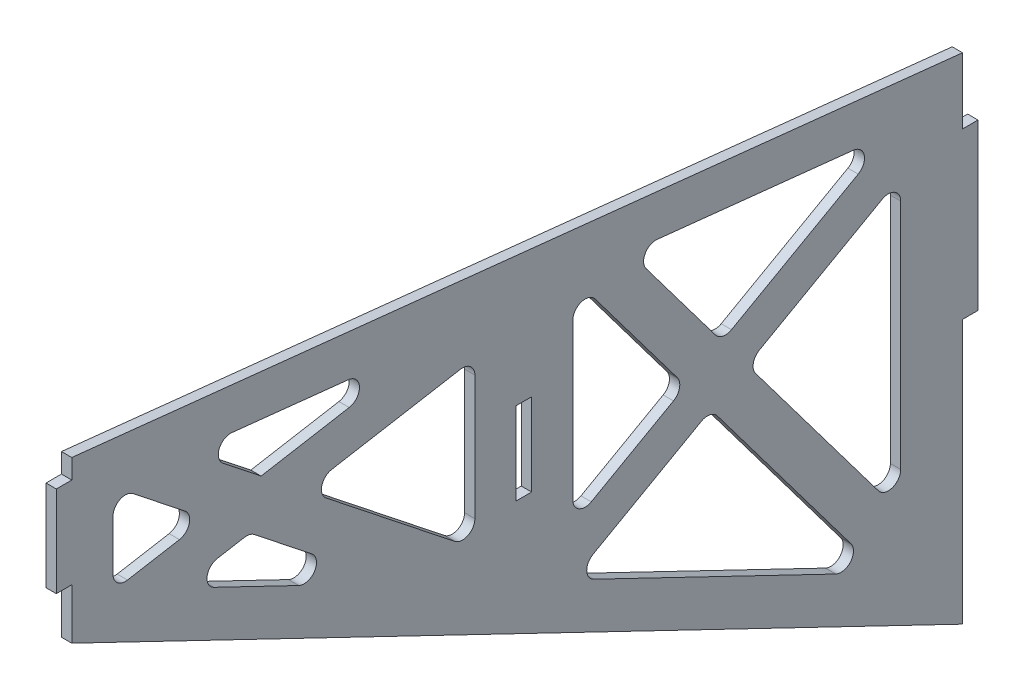
from build123d import *

# Parameters (mm, degrees)
BOSS_EXTRUDE1_DEPTH = 3.175
SKETCH4_W           = 4.7625
SKETCH4_H           = 25.4
CUT_EXTRUDE1_DEPTH  = 318.998242812
BOSS_EXTRUDE2_DEPTH = 3.175
SKETCH8_W           = 4.7625
SKETCH8_H           = 25.4
BOSS_EXTRUDE3_DEPTH = 3.175
CUT_EXTRUDE2_DEPTH  = 3.175
FILLET1_R           = 3.81


with BuildPart() as part:
    # Sketch3 → Boss-Extrude1 (new body)
    with BuildSketch(Plane(origin=(0, 0, 0), x_dir=(0, 0, -1), z_dir=(1, 0, 0))):
        Polygon((0, 0), (274.32, 0), (274.32, -20.32), (279.0825, -20.32), (279.0825, -71.12), (274.32, -71.12), (274.32, -152.4), (0, -20.32), (0, -4.736956919), (-4.7625, -4.736956919), (-4.7625, -2.196956919), (0, -2.196956919), align=None)
    extrude(amount=BOSS_EXTRUDE1_DEPTH)

    # Sketch4 → Cut-Extrude1 (cut, through all)
    with BuildSketch(Plane(origin=(3.175, 0, 0), x_dir=(0, 0, -1), z_dir=(1, 0, 0))):
        with Locations((139.22375, -38.1)):
            Rectangle(SKETCH4_W, SKETCH4_H)
    extrude(amount=-CUT_EXTRUDE1_DEPTH, mode=Mode.SUBTRACT)

    # Sketch7 → Boss-Extrude2 (add)
    with BuildSketch(Plane(origin=(3.175, 0, 0), x_dir=(0, 0, -1), z_dir=(1, 0, 0))):
        Polygon((0, 0), (274.32, 0), (0, 29.21), align=None)
    extrude(amount=-BOSS_EXTRUDE2_DEPTH)

    # Sketch8 → Boss-Extrude3 (add)
    with BuildSketch(Plane(origin=(3.175, 0, 0), x_dir=(0, 0, -1), z_dir=(1, 0, 0))):
        with Locations((-2.38125, 10.503043081)):
            Rectangle(SKETCH8_W, SKETCH8_H)
    extrude(amount=-BOSS_EXTRUDE3_DEPTH)

    # Sketch9 → Cut-Extrude2 (cut)
    with BuildSketch(Plane(origin=(3.175, 0, 0), x_dir=(0, 0, -1), z_dir=(1, 0, 0))):
        Polygon((36.259032566, 12.577289188), (112.24402044, 4.486295109), (58.30952194, -4.892268607), align=None)
        Polygon((12.7, -12.823218546), (12.7, 15.039341432), (41.539031051, -7.808456237), align=None)
        Polygon((33.107422432, -22.165187422), (54.881369429, -18.378958664), (100.799344517, -54.757594352), align=None)
        Polygon((71.651860318, -15.462771034), (124.1425, -6.335277083), (124.1425, -57.048617412), align=None)
        Polygon((171.586571882, -1.832587683), (252.565242685, -10.455316519), (200.256550247, -39.917404217), align=None)
        Polygon((154.305, 0.007579693), (154.305, -65.798926774), (189.093407911, -46.204876971), align=None)
        Polygon((196.79890844, -56.44076101), (154.166437984, -80.452861577), (249.389029774, -126.300776142), align=None)
        Polygon((207.962050776, -50.153288256), (255.27, -23.507794287), (255.27, -112.996536471), align=None)
    extrude(amount=-CUT_EXTRUDE2_DEPTH, mode=Mode.SUBTRACT)

    # Fillet1
    fillet1_edges = [part.edges().sort_by_distance(p)[0] for p in [
        (1.5875, -65.798926774, -154.305),
        (1.5875, -46.204876971, -189.093407911),
        (1.5875, 0.007579693, -154.305),
        (1.5875, -6.335277083, -124.1425),
        (1.5875, -57.048617412, -124.1425),
        (1.5875, -15.462771034, -71.651860318),
        (1.5875, -18.378958664, -54.881369429),
        (1.5875, -54.757594352, -100.799344517),
        (1.5875, -22.165187422, -33.107422432),
        (1.5875, 4.486295109, -112.24402044),
        (1.5875, 12.577289188, -36.259032566),
        (1.5875, -80.452861577, -154.166437984),
        (1.5875, -126.300776142, -249.389029774),
        (1.5875, -56.44076101, -196.79890844),
        (1.5875, -10.455316519, -252.565242685),
        (1.5875, -39.917404217, -200.256550247),
        (1.5875, -1.832587683, -171.586571882),
        (1.5875, -23.507794287, -255.27),
        (1.5875, -112.996536471, -255.27),
        (1.5875, -50.153288256, -207.962050776),
        (1.5875, 15.039341432, -12.7),
        (1.5875, -7.808456237, -41.539031051),
        (1.5875, -12.823218546, -12.7),
    ]]
    fillet(fillet1_edges, radius=FILLET1_R)


solid = part.part
